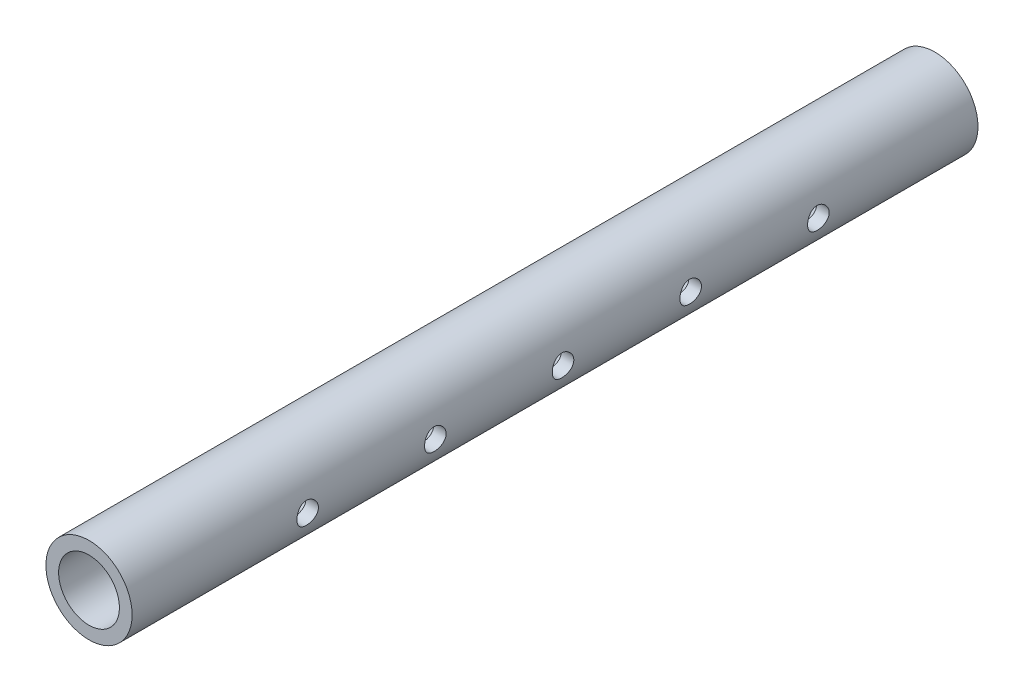
from build123d import *

# Parameters (mm, degrees)
SKETCH1_R                   = 13.5
SKETCH1_R_2                 = 9.525
F_1_4_CLEARANCE_HOLE2_D     = 6.7564
F_1_4_CLEARANCE_HOLE2_DEPTH = 13.5


with BuildPart() as part:
    # Sweep1: sweep along a curve in space
    with BuildLine() as sweep1_path:
        Line((0, 0, 0), (0, 0, -265))
    # Sketch1 → Sweep1 (sweep)
    with BuildSketch(Plane.XY):
        Circle(SKETCH1_R)
        Circle(SKETCH1_R_2, mode=Mode.SUBTRACT)
    sweep(path=sweep1_path.line)

    # 1/4 Clearance Hole2
    with Locations(Plane(origin=(13.5, 0, -215), x_dir=(0, 1, 0), z_dir=(1, 0, 0))):
        with Locations((0, 0), (0, 160), (0, 120), (0, 80), (0, 40)):
            Hole(F_1_4_CLEARANCE_HOLE2_D / 2, depth=F_1_4_CLEARANCE_HOLE2_DEPTH)


solid = part.part
